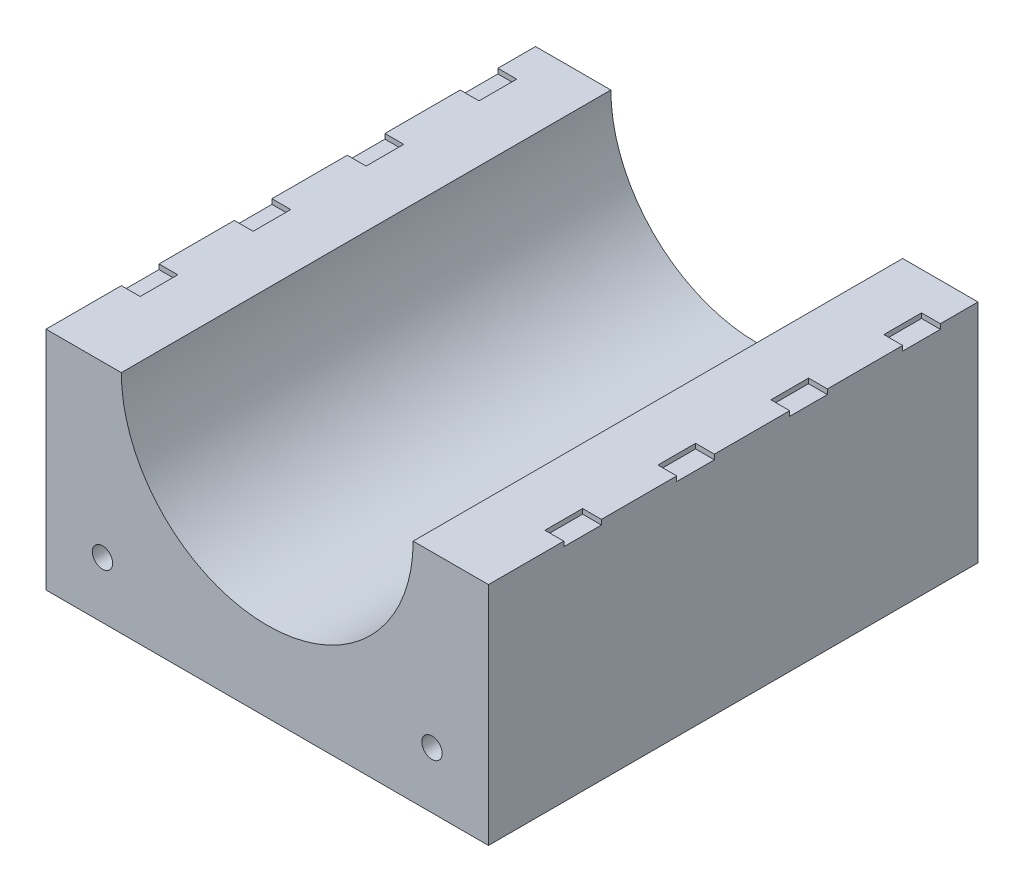
from build123d import *

# Parameters (mm, degrees)
SKETCH1_R                    = 3.429
BOSS_EXTRUDE1_DEPTH          = 165.1
SKETCH2_W                    = 12.954
SKETCH2_H                    = 12.954
CUT_EXTRUDE1_DEPTH           = 6.35
CUT_EXTRUDE1_DRAFT           = -45
CUT_EXTRUDE1_PROFILE_2_DEPTH = 6.35
CUT_EXTRUDE1_PROFILE_2_DRAFT = -45
CUT_EXTRUDE1_PROFILE_3_DEPTH = 6.35
CUT_EXTRUDE1_PROFILE_3_DRAFT = -45
SKETCH3_W                    = 6.35
SKETCH3_H                    = 12.7
CUT_EXTRUDE2_DEPTH           = 1.651


with BuildPart() as part:
    # Sketch1 → Boss-Extrude1 (new body)
    with BuildSketch(Plane.XY):
        with BuildLine():
            Line((-49.2125, 0), (-74.6125, 0))
            Line((-74.6125, 0), (-74.6125, -76.2))
            Line((-74.6125, -76.2), (74.6125, -76.2))
            Line((74.6125, -76.2), (74.6125, 0))
            Line((74.6125, 0), (49.2125, 0))
            ThreePointArc((49.2125, 0), (0, -49.2125), (-49.2125, 0))
        make_face()
        with Locations((-55.5625, -57.15)):
            Circle(SKETCH1_R, mode=Mode.SUBTRACT)
        with Locations((55.5625, -57.15)):
            Circle(SKETCH1_R, mode=Mode.SUBTRACT)
    extrude(amount=BOSS_EXTRUDE1_DEPTH)


with BuildPart() as cut_extrude1_tool:
    # Sketch2 → Cut-Extrude1 (with draft: the straight prism first)
    with BuildSketch(Plane(origin=(0, 0, 0), x_dir=(-1, 0, 0), z_dir=(0, 0, -1))):
        with Locations((-61.9125, -19.05)):
            Rectangle(SKETCH2_W, SKETCH2_H)
    extrude(amount=-CUT_EXTRUDE1_DEPTH)
    # Cut-Extrude1: the draft: its side faces are tilted about the plane it starts from
    cut_extrude1_sides = [cut_extrude1_tool.faces().sort_by_distance(p)[0] for p in [
        (68.3895, -19.05, 3.175),
        (61.9125, -25.527, 3.175),
        (55.4355, -19.05, 3.175),
        (61.9125, -12.573, 3.175),
    ]]
    draft(cut_extrude1_sides, Plane(origin=(0, 0, 0), x_dir=(-1, 0, 0), z_dir=(0, 0, -1)), CUT_EXTRUDE1_DRAFT)


with BuildPart() as part_1:
    add(part.part)

    # Cut-Extrude1: cut by cut_extrude1_tool
    add(cut_extrude1_tool.part, mode=Mode.SUBTRACT)


with BuildPart() as cut_extrude1_profile_2_tool:
    # Sketch2 → Cut-Extrude1 profile 2 (with draft: the straight prism first)
    with BuildSketch(Plane(origin=(0, 0, 0), x_dir=(-1, 0, 0), z_dir=(0, 0, -1))):
        with Locations((0, -63.5)):
            Rectangle(SKETCH2_W, SKETCH2_H)
    extrude(amount=-CUT_EXTRUDE1_PROFILE_2_DEPTH)
    # Cut-Extrude1 profile 2: the draft: its side faces are tilted about the plane it starts from
    cut_extrude1_profile_2_sides = [cut_extrude1_profile_2_tool.faces().sort_by_distance(p)[0] for p in [
        (6.477, -63.5, 3.175),
        (0, -69.977, 3.175),
        (-6.477, -63.5, 3.175),
        (0, -57.023, 3.175),
    ]]
    draft(cut_extrude1_profile_2_sides, Plane(origin=(0, 0, 0), x_dir=(-1, 0, 0), z_dir=(0, 0, -1)), CUT_EXTRUDE1_PROFILE_2_DRAFT)


with BuildPart() as part_2:
    add(part_1.part)

    # Cut-Extrude1 profile 2: cut by cut_extrude1_profile_2_tool
    add(cut_extrude1_profile_2_tool.part, mode=Mode.SUBTRACT)


with BuildPart() as cut_extrude1_profile_3_tool:
    # Sketch2 → Cut-Extrude1 profile 3 (with draft: the straight prism first)
    with BuildSketch(Plane(origin=(0, 0, 0), x_dir=(-1, 0, 0), z_dir=(0, 0, -1))):
        with Locations((61.9125, -19.05)):
            Rectangle(SKETCH2_W, SKETCH2_H)
    extrude(amount=-CUT_EXTRUDE1_PROFILE_3_DEPTH)
    # Cut-Extrude1 profile 3: the draft: its side faces are tilted about the plane it starts from
    cut_extrude1_profile_3_sides = [cut_extrude1_profile_3_tool.faces().sort_by_distance(p)[0] for p in [
        (-55.4355, -19.05, 3.175),
        (-61.9125, -25.527, 3.175),
        (-68.3895, -19.05, 3.175),
        (-61.9125, -12.573, 3.175),
    ]]
    draft(cut_extrude1_profile_3_sides, Plane(origin=(0, 0, 0), x_dir=(-1, 0, 0), z_dir=(0, 0, -1)), CUT_EXTRUDE1_PROFILE_3_DRAFT)


with BuildPart() as part_3:
    add(part_2.part)

    # Cut-Extrude1 profile 3: cut by cut_extrude1_profile_3_tool
    add(cut_extrude1_profile_3_tool.part, mode=Mode.SUBTRACT)

    # Sketch3 → Cut-Extrude2 (cut)
    with BuildSketch(Plane(origin=(0, 0, 0), x_dir=(1, 0, 0), z_dir=(0, 1, 0))):
        with Locations((71.4375, -19.05)):
            Rectangle(SKETCH3_W, SKETCH3_H)
        with Locations((71.4375, -57.15)):
            Rectangle(SKETCH3_W, SKETCH3_H)
        with Locations((71.4375, -95.25)):
            Rectangle(SKETCH3_W, SKETCH3_H)
        with Locations((71.4375, -133.35)):
            Rectangle(SKETCH3_W, SKETCH3_H)
        with Locations((-71.4375, -57.15)):
            Rectangle(SKETCH3_W, SKETCH3_H)
        with Locations((-71.4375, -95.25)):
            Rectangle(SKETCH3_W, SKETCH3_H)
        with Locations((-71.4375, -133.35)):
            Rectangle(SKETCH3_W, SKETCH3_H)
        with Locations((-71.4375, -19.05)):
            Rectangle(SKETCH3_W, SKETCH3_H)
    extrude(amount=-CUT_EXTRUDE2_DEPTH, mode=Mode.SUBTRACT)


solid = part_3.part
